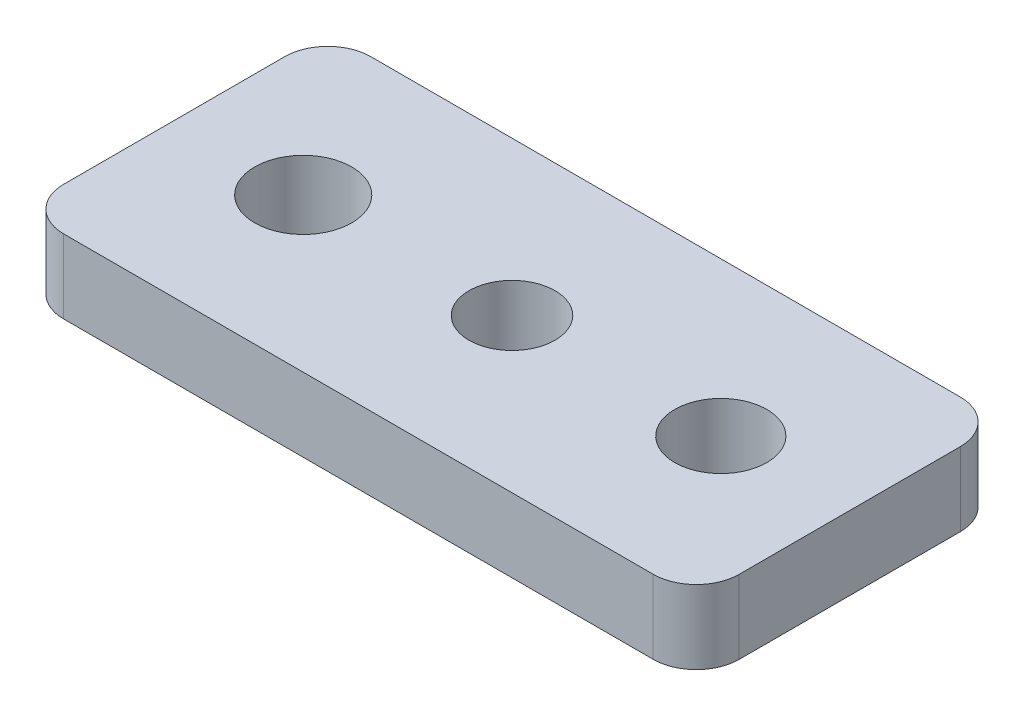
from build123d import *

# Parameters (mm, degrees)
SKETCH1_W           = 55
SKETCH1_H           = 25
BOSS_EXTRUDE1_DEPTH = 6
SKETCH2_R           = 3.5
SKETCH2_R_2         = 3.75
SKETCH2_R_3         = 3.95
CUT_EXTRUDE1_DEPTH  = 6
FILLET1_R           = 3.5


with BuildPart() as part:
    # Sketch1 → Boss-Extrude1 (new body)
    with BuildSketch(Plane(origin=(0, 0, 0), x_dir=(1, 0, 0), z_dir=(0, 1, 0))):
        Rectangle(SKETCH1_W, SKETCH1_H)
    extrude(amount=BOSS_EXTRUDE1_DEPTH)

    # Sketch2 → Cut-Extrude1 (cut)
    with BuildSketch(Plane(origin=(0, 6, 0), x_dir=(1, 0, 0), z_dir=(0, 1, 0))):
        with Locations(Location((0, 0, 0), (0, 0, 270))):
            Circle(SKETCH2_R)
        with Locations(Location((17, 0, 0), (0, 0, 270))):
            Circle(SKETCH2_R_2)
        with Locations(Location((-17, 0, 0), (0, 0, 270))):
            Circle(SKETCH2_R_3)
    extrude(amount=-CUT_EXTRUDE1_DEPTH, mode=Mode.SUBTRACT)

    # Fillet1
    fillet1_edges = [part.edges().sort_by_distance(p)[0] for p in [
        (27.5, 3, 12.5),
        (-27.5, 3, 12.5),
        (-27.5, 3, -12.5),
        (27.5, 3, -12.5),
    ]]
    fillet(fillet1_edges, radius=FILLET1_R)


solid = part.part
